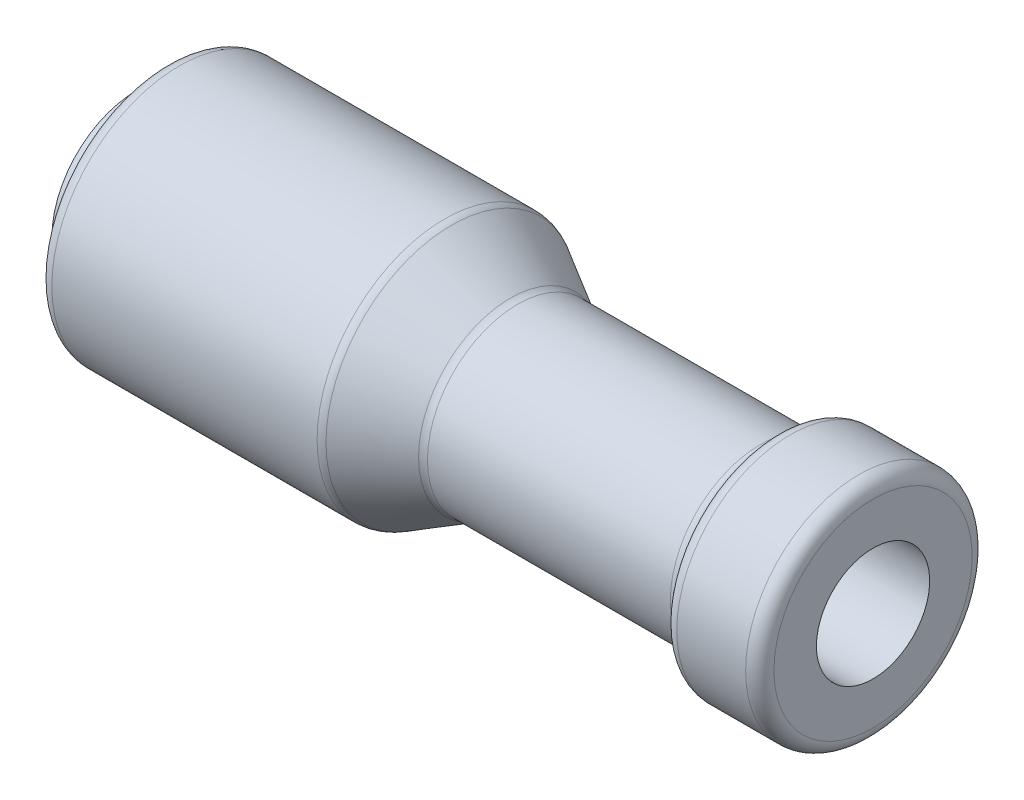
from build123d import *

# Parameters (mm, degrees)
FILLET_1_R = 0.5


with BuildPart() as part:
    # Эскиз1 → Повернуть1 (revolve)
    with BuildSketch(Plane(origin=(0, 0, 0), x_dir=(1, 0, 0), z_dir=(0, 1, 0)), mode=Mode.PRIVATE) as revolve_1_sk:
        Polygon((-20.31661762, 2), (-20.31661762, 3), (-19.31661762, 3), (-19.31661762, 4.5), (-9.31661762, 4.5), (-7.005272431, 3.180480624), (1.994727569, 3.180480624), (2.462581397, 4), (5.68338238, 4), (5.68338238, 2), align=None)
    revolve(revolve_1_sk.sketch.rotate(Axis((-48.681122779, 0, 0), (1, 0, 0)), 180), axis=Axis((-48.681122779, 0, 0), (1, 0, 0)))

    # Скругление1
    fillet_1_edges = [part.edges().sort_by_distance(p)[0] for p in [
        (-19.31661762, 0, -4.5),
        (-9.31661762, 0, -4.5),
        (-7.005272431, 0, -3.180480624),
        (1.994727569, 0, -3.180480624),
        (2.462581397, 0, -4),
        (5.68338238, 0, -4),
    ]]
    fillet(fillet_1_edges, radius=FILLET_1_R)


solid = part.part
